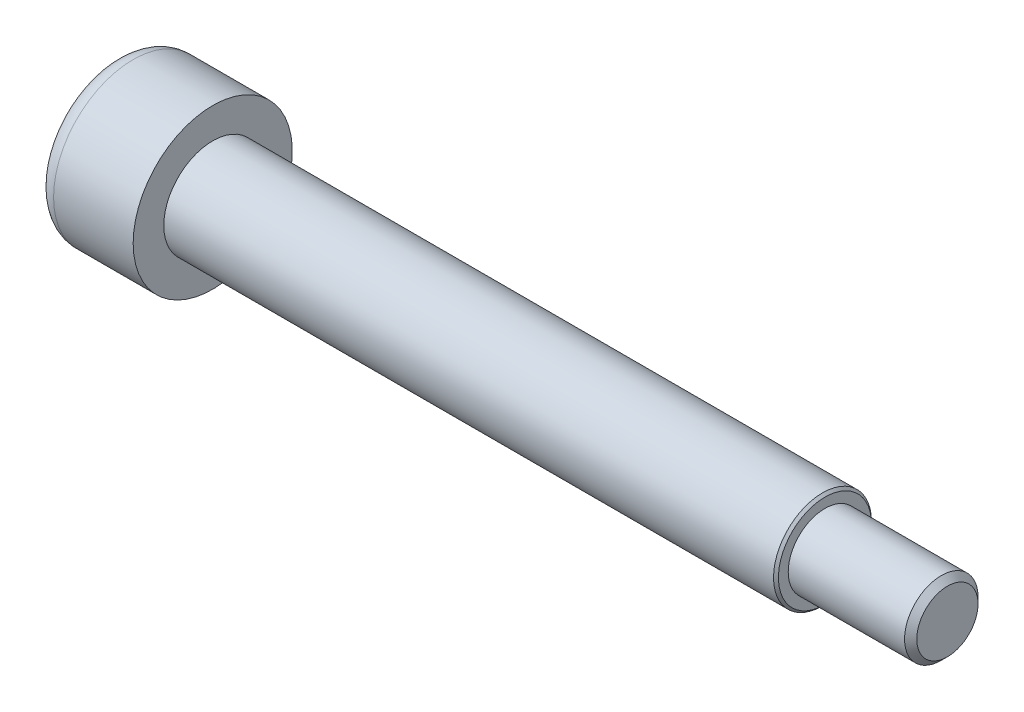
from build123d import *

# Parameters (mm, degrees)
CHANFREIN1_SIZE = 0.5
CONG_1_R        = 1.5
CHANFREIN2_SIZE = 0.2


with BuildPart() as part:
    # Esquisse1 → Base-Révolution (revolve)
    with BuildSketch(Plane.XY, mode=Mode.PRIVATE) as base_r_volution_sk:
        Polygon((60, 0), (60, -3), (50, -3), (50, -4), (0, -4), (0, -6.5), (-8, -6.5), (-8, 0), align=None)
    revolve(base_r_volution_sk.sketch.rotate(Axis((0, 0, 0), (1, 0, 0)), 270), axis=Axis((0, 0, 0), (1, 0, 0)))

    # Chanfrein1
    chanfrein1_edges = [part.edges().sort_by_distance(p)[0] for p in [
        (60, 0, -3),
    ]]
    chamfer(chanfrein1_edges, length=CHANFREIN1_SIZE)

    # Congé1
    cong_1_edges = [part.edges().sort_by_distance(p)[0] for p in [
        (-8, 0, -6.5),
    ]]
    fillet(cong_1_edges, radius=CONG_1_R)

    # Chanfrein2
    chanfrein2_edges = [part.edges().sort_by_distance(p)[0] for p in [
        (50, 0, -4),
    ]]
    chamfer(chanfrein2_edges, length=CHANFREIN2_SIZE)


solid = part.part
